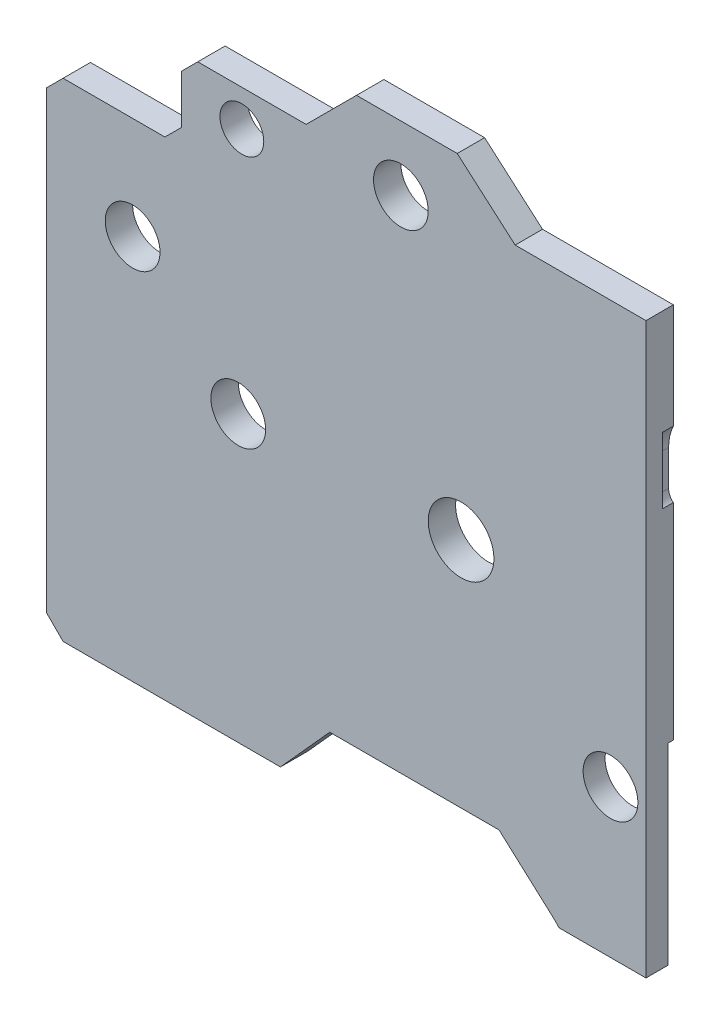
from build123d import *

# Parameters (mm, degrees)
SKETCH_1_R          = 3
SKETCH_1_R_2        = 2.5
EXTRUDE_1_DEPTH     = 2.5
EXTRUDE_START       = -2
SKETCH_3_R          = 2.5
EXTRUDE_3_DEPTH     = 2
SKETCH_7_R          = 2.65
CUT_EXTRUDE_1_DEPTH = 1
CHAMFER_1_SIZE      = 1
CUT_EXTRUDE_3_REACH = 53.597
SKETCH_10_R         = 2.5
CUT_EXTRUDE_4_REACH = 53.635
CHAMFER_2_SIZE      = 1.5
CUT_EXTRUDE_5_REACH = 53.635
CHAMFER_3_SIZE      = 2
CUT_EXTRUDE_6_REACH = 49.547
SKETCH_15_W         = 9
SKETCH_15_H         = 44.55
SKETCH_15_H_2       = 52
CUT_EXTRUDE_7_REACH = 42.704
SKETCH_16_R         = 2.5
CHAMFER_4_SIZE      = 1.5
SKETCH_17_R         = 2
CUT_EXTRUDE_8_DEPTH = 10


with BuildPart() as part:
    # 스케치1 → 보스-돌출1 (new body)
    with BuildSketch(Plane.XY):
        with BuildLine():
            Line((-27.349187557, -28.196867314), (-7.694270353, -28.196867314))
            Line((-7.694270353, -28.196867314), (-3.192250131, -23.196867314))
            Line((-3.192250131, -23.196867314), (12.267749869, -23.196867314))
            Line((12.267749869, -23.196867314), (17.250812443, -27.683637009))
            Line((17.250812443, -27.683637009), (17.250812443, -14.696867314))
            ThreePointArc((17.250812443, -14.696867314), (22.450812443, -9.496867314), (27.650812443, -14.696867314))
            Line((27.650812443, -14.696867314), (27.650812443, -28.196867314))
            Line((27.650812443, -28.196867314), (40.650812443, -28.196867314))
            Line((40.650812443, -28.196867314), (40.650812443, 12.183132686))
            Line((40.650812443, 12.183132686), (28.992507116, 23.803132686))
            Line((28.992507116, 23.803132686), (13.742507116, 23.803132686))
            Line((13.742507116, 23.803132686), (8.450812443, 28.403132686))
            Line((8.450812443, 28.403132686), (-0.749187557, 28.403132686))
            Line((-0.749187557, 28.403132686), (-5.349187557, 23.803132686))
            Line((-5.349187557, 23.803132686), (-28.149187557, 23.803132686))
            Line((-28.149187557, 23.803132686), (-43.049187557, 8.903132686))
            Line((-43.049187557, 8.903132686), (-43.049187557, -28.196867314))
            Line((-43.049187557, -28.196867314), (-37.749187557, -28.196867314))
            Line((-37.749187557, -28.196867314), (-37.749187557, -3.196867314))
            ThreePointArc((-37.749187557, -3.196867314), (-29.949187557, 1.306464785), (-29.949187557, -7.700199414))
            Line((-29.949187557, -7.700199414), (-29.949187557, -28.196867314))
            Line((-29.949187557, -28.196867314), (-27.349187557, -28.196867314))
        make_face()
        with Locations((8.802507116, -1.986867314)):
            Circle(SKETCH_1_R, mode=Mode.SUBTRACT)
        with Locations((-21.197492884, 7.013132686)):
            Circle(SKETCH_1_R_2, mode=Mode.SUBTRACT)
        with Locations((3.302507116, 22.513132686)):
            Circle(SKETCH_1_R_2, mode=Mode.SUBTRACT)
    extrude(amount=EXTRUDE_1_DEPTH)

    # 스케치3 → 보스-돌출3 (add)
    # profile 1 of 2: a face of its own
    with BuildSketch(Plane.XY.offset(2.5).offset(EXTRUDE_START)):
        with BuildLine():
            Line((27.650812443, -14.696867314), (27.650812443, -28.196867314))
            Line((27.650812443, -28.196867314), (17.764042748, -28.196867314))
            Line((17.764042748, -28.196867314), (17.250812443, -27.683637009))
            Line((17.250812443, -27.683637009), (17.250812443, -14.696867314))
            ThreePointArc((17.250812443, -14.696867314), (22.450812443, -9.496867314), (27.650812443, -14.696867314))
        make_face()
        with Locations((22.450812443, -14.696867314)):
            Circle(SKETCH_3_R, mode=Mode.SUBTRACT)
    # profile 2 of 2: a face of its own
    with BuildSketch(Plane.XY.offset(2.5).offset(EXTRUDE_START)):
        with BuildLine():
            Line((-29.949187557, -7.700199414), (-29.949187557, -28.196867314))
            Line((-29.949187557, -28.196867314), (-30.049187557, -28.196867314))
            Line((-30.049187557, -28.196867314), (-37.749187557, -28.196867314))
            Line((-37.749187557, -28.196867314), (-37.749187557, -3.196867314))
            ThreePointArc((-37.749187557, -3.196867314), (-29.949187557, 1.306464785), (-29.949187557, -7.700199414))
        make_face()
        with Locations((-32.549187557, -3.196867314)):
            Circle(SKETCH_3_R, mode=Mode.SUBTRACT)
    extrude(amount=EXTRUDE_3_DEPTH)

    # 스케치7 → 컷-돌출1 (cut)
    with BuildSketch(Plane(origin=(0, 0, 0), x_dir=(-1, 0, 0), z_dir=(0, 0, -1))):
        with Locations((6.149187557, 20.803132686)):
            Circle(SKETCH_7_R)
        with Locations((8.049187557, -24.196867314)):
            Circle(SKETCH_7_R)
        with BuildLine():
            Line((-26.406412787, 7.908733029), (-32.895212099, 7.908733029))
            ThreePointArc((-32.895212099, 7.908733029), (-33.708384897, 8.245560231), (-34.045212099, 9.058733029))
            Line((-34.045212099, 9.058733029), (-34.045212099, 15.547532342))
            ThreePointArc((-34.045212099, 15.547532342), (-33.708384897, 16.36070514), (-32.895212099, 16.697532342))
            Line((-32.895212099, 16.697532342), (-29.650812443, 16.697532342))
            ThreePointArc((-29.650812443, 16.697532342), (-26.543502647, 15.410442482), (-25.256412787, 12.303132686))
            Line((-25.256412787, 12.303132686), (-25.256412787, 9.058733029))
            ThreePointArc((-25.256412787, 9.058733029), (-25.593239988, 8.245560231), (-26.406412787, 7.908733029))
        make_face()
    extrude(amount=-CUT_EXTRUDE_1_DEPTH, mode=Mode.SUBTRACT)

    # 모따기1
    chamfer_1_edges = [part.edges().sort_by_distance(p)[0] for p in [
        (-43.049187557, -28.196867314, 1.25),
        (40.650812443, -28.196867314, 1.25),
    ]]
    chamfer(chamfer_1_edges, length=CHAMFER_1_SIZE)

    # 스케치10 → 컷-돌출3 (cut, up to next)
    with BuildSketch(Plane(origin=(0, 0, 1), x_dir=(-1, 0, 0), z_dir=(0, 0, -1)), mode=Mode.PRIVATE) as cut_extrude_3_sk1:
        with Locations((-29.650812443, 12.303132686)):
            Circle(SKETCH_10_R)
    cut_extrude_3_tool1 = extrude(cut_extrude_3_sk1.sketch, amount=-CUT_EXTRUDE_3_REACH, mode=Mode.PRIVATE) & part.part
    add(cut_extrude_3_tool1.solids().sort_by_distance((29.650812, 12.303133, 1))[0], mode=Mode.SUBTRACT)

    # 스케치12 → 컷-돌출4 (cut, up to next)
    with BuildSketch(Plane(origin=(0, 0, 0), x_dir=(-1, 0, 0), z_dir=(0, 0, -1)), mode=Mode.PRIVATE) as cut_extrude_4_sk1:
        Polygon((16.749187557, 23.803132686), (16.749187557, 16.353132686), (35.599187557, 16.353132686), (28.149187557, 23.803132686), align=None)
    cut_extrude_4_tool1 = extrude(cut_extrude_4_sk1.sketch, amount=-CUT_EXTRUDE_4_REACH, mode=Mode.PRIVATE) & part.part
    add(cut_extrude_4_tool1.solids().sort_by_distance((-24.464587, 19.772334, 0))[0], mode=Mode.SUBTRACT)

    # 모따기2
    chamfer_2_edges = [part.edges().sort_by_distance(p)[0] for p in [
        (-16.749187557, 23.803132686, 1.25),
        (-16.749187557, 16.353132686, 1.25),
    ]]
    chamfer(chamfer_2_edges, length=CHAMFER_2_SIZE)

    # 스케치13 → 컷-돌출5 (cut, up to next)
    with BuildSketch(Plane(origin=(0, 0, 0), x_dir=(-1, 0, 0), z_dir=(0, 0, -1)), mode=Mode.PRIVATE) as cut_extrude_5_sk1:
        Polygon((-34.689283113, 18.125074406), (-34.689283113, -28.196867314), (-39.650812443, -28.196867314), (-40.650812443, -27.196867314), (-40.650812443, 12.183132686), align=None)
    cut_extrude_5_tool1 = extrude(cut_extrude_5_sk1.sketch, amount=-CUT_EXTRUDE_5_REACH, mode=Mode.PRIVATE) & part.part
    # 스케치13 → 컷-돌출5 (cut, up to next)
    with BuildSketch(Plane(origin=(0, 0, 0), x_dir=(-1, 0, 0), z_dir=(0, 0, -1)), mode=Mode.PRIVATE) as cut_extrude_5_sk2:
        Polygon((38.049187557, 13.903132686), (43.049187557, 8.903132686), (43.049187557, -27.196867314), (42.049187557, -28.196867314), (38.049187557, -28.196867314), align=None)
    cut_extrude_5_tool2 = extrude(cut_extrude_5_sk2.sketch, amount=-CUT_EXTRUDE_5_REACH, mode=Mode.PRIVATE) & part.part
    add(cut_extrude_5_tool1.solids().sort_by_distance((37.59669, -6.446011, 0))[0], mode=Mode.SUBTRACT)
    add(cut_extrude_5_tool2.solids().sort_by_distance((-40.49096, -8.321213, 0))[0], mode=Mode.SUBTRACT)

    # 모따기3
    chamfer_3_edges = [part.edges().sort_by_distance(p)[0] for p in [
        (-38.049187557, -28.196867314, 1.25),
        (34.689283113, -28.196867314, 1.25),
    ]]
    chamfer(chamfer_3_edges, length=CHAMFER_3_SIZE)

    # 스케치15 → 컷-돌출6 (cut, up to next)
    with BuildSketch(Plane.XY.offset(2.5), mode=Mode.PRIVATE) as cut_extrude_6_sk1:
        with Locations((-33.549187557, -5.921867314)):
            Rectangle(SKETCH_15_W, SKETCH_15_H)
    cut_extrude_6_tool1 = extrude(cut_extrude_6_sk1.sketch, amount=-CUT_EXTRUDE_6_REACH, mode=Mode.PRIVATE) & part.part
    # 스케치15 → 컷-돌출6 (cut, up to next)
    with BuildSketch(Plane.XY.offset(2.5), mode=Mode.PRIVATE) as cut_extrude_6_sk2:
        with Locations((30.189283113, -2.196867314)):
            Rectangle(SKETCH_15_W, SKETCH_15_H_2)
    cut_extrude_6_tool2 = extrude(cut_extrude_6_sk2.sketch, amount=-CUT_EXTRUDE_6_REACH, mode=Mode.PRIVATE) & part.part
    add(cut_extrude_6_tool1.solids().sort_by_distance((-33.549188, -5.921867, 2.5))[0], mode=Mode.SUBTRACT)
    add(cut_extrude_6_tool2.solids().sort_by_distance((30.189283, -2.196867, 2.5))[0], mode=Mode.SUBTRACT)

    # 스케치16 → 컷-돌출7 (cut, up to next)
    with BuildSketch(Plane(origin=(0, 0, 0), x_dir=(-1, 0, 0), z_dir=(0, 0, -1)), mode=Mode.PRIVATE) as cut_extrude_7_sk1:
        with Locations((11.549187557, -2.196867314)):
            Circle(SKETCH_16_R)
    cut_extrude_7_tool1 = extrude(cut_extrude_7_sk1.sketch, amount=-CUT_EXTRUDE_7_REACH, mode=Mode.PRIVATE) & part.part
    add(cut_extrude_7_tool1.solids().sort_by_distance((-11.549188, -2.196867, 0))[0], mode=Mode.SUBTRACT)

    # 모따기4
    chamfer_4_edges = [part.edges().sort_by_distance(p)[0] for p in [
        (-29.049187557, 16.353132686, 1.25),
        (-29.049187557, -28.196867314, 1.25),
    ]]
    chamfer(chamfer_4_edges, length=CHAMFER_4_SIZE)

    # 스케치17 → 컷-돌출8 (cut)
    with BuildSketch(Plane(origin=(0, 0, 0), x_dir=(-1, 0, 0), z_dir=(0, 0, -1))):
        with Locations((11.219187557, 20.503132686)):
            Circle(SKETCH_17_R)
    extrude(amount=-CUT_EXTRUDE_8_DEPTH, mode=Mode.SUBTRACT)


solid = part.part
